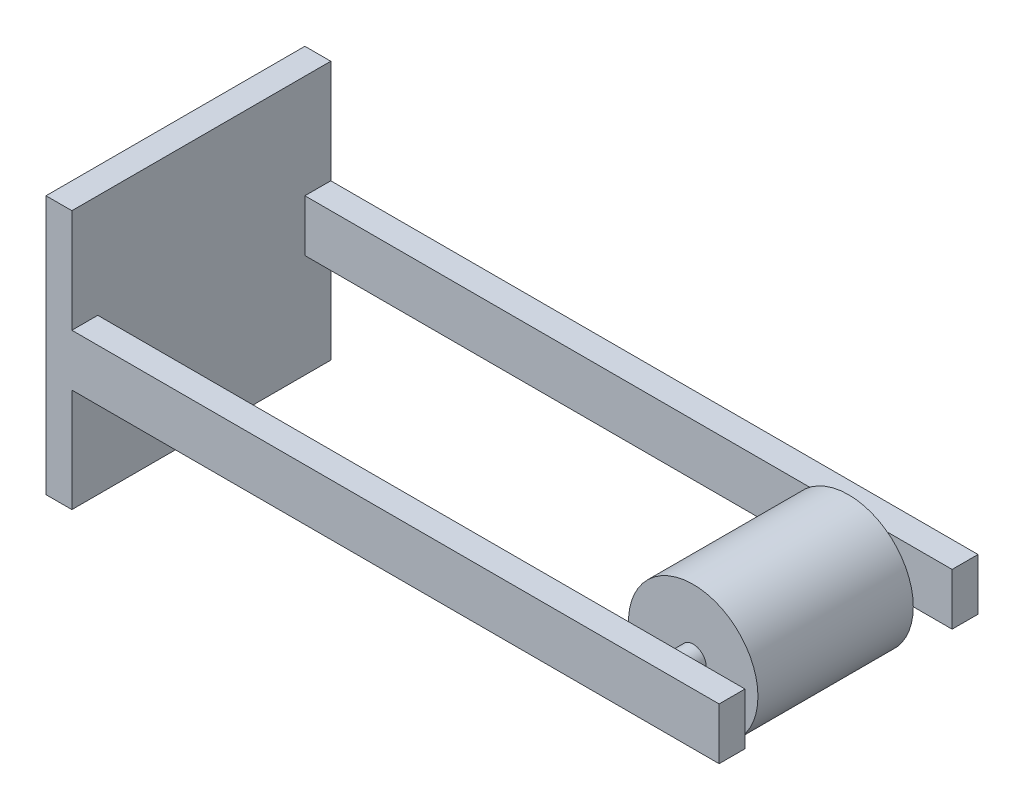
from build123d import *

# Parameters (mm, degrees)
SKETCH_1_W          = 10
SKETCH_1_H          = 10
EXTRUDE_1_DEPTH     = 1
SKETCH_2_W          = 25
SKETCH_2_H          = 2
EXTRUDE_2_DEPTH     = 1
SKETCH_3_W          = 25
SKETCH_3_H          = 2
EXTRUDE_3_DEPTH     = 1
SKETCH_4_R          = 2.5
EXTRUDE_4_DEPTH     = 8
SKETCH_5_R          = 2.5
SKETCH_5_R_2        = 0.5
CUT_EXTRUDE_3_DEPTH = 1
CUT_EXTRUDE_START   = -1
SKETCH_6_R          = 2.5
SKETCH_6_R_2        = 0.5
CUT_EXTRUDE_4_DEPTH = 1


with BuildPart() as part:
    # 草图1 → 凸台-拉伸1 (new body)
    with BuildSketch(Plane(origin=(0, 0, 0), x_dir=(0, 0, -1), z_dir=(1, 0, 0))):
        with Locations((5, 5)):
            Rectangle(SKETCH_1_W, SKETCH_1_H)
    extrude(amount=EXTRUDE_1_DEPTH)

    # 草图2 → 凸台-拉伸2 (add)
    with BuildSketch(Plane.XY):
        with Locations((13.5, 5)):
            Rectangle(SKETCH_2_W, SKETCH_2_H)
    extrude(amount=-EXTRUDE_2_DEPTH)

    # 草图3 → 凸台-拉伸3 (add)
    with BuildSketch(Plane(origin=(0, 0, -10), x_dir=(-1, 0, 0), z_dir=(0, 0, -1))):
        with Locations((-13.5, 5)):
            Rectangle(SKETCH_3_W, SKETCH_3_H)
    extrude(amount=-EXTRUDE_3_DEPTH)

    # 草图4 → 凸台-拉伸4 (add)
    with BuildSketch(Plane(origin=(0, 0, -1), x_dir=(-1, 0, 0), z_dir=(0, 0, -1))):
        with Locations(Location((-23, 5, 0), (0, 0, 203.578178478))):
            Circle(SKETCH_4_R)
    extrude(amount=EXTRUDE_4_DEPTH)

    # 草图5 → 切除-拉伸3 (cut)
    with BuildSketch(Plane.XY.offset(-1)):
        with Locations((23, 5)):
            Circle(SKETCH_5_R)
        with Locations((23, 5)):
            Circle(SKETCH_5_R_2, mode=Mode.SUBTRACT)
    extrude(amount=-CUT_EXTRUDE_3_DEPTH, mode=Mode.SUBTRACT)

    # 草图6 → 切除-拉伸4 (cut)
    with BuildSketch(Plane(origin=(0, 0, -9), x_dir=(-1, 0, 0), z_dir=(0, 0, -1)).offset(CUT_EXTRUDE_START)):
        with Locations(Location((-23, 5, 0), (0, 0, 180))):
            Circle(SKETCH_6_R)
        with Locations(Location((-23, 5, 0), (0, 0, 180))):
            Circle(SKETCH_6_R_2, mode=Mode.SUBTRACT)
    extrude(amount=CUT_EXTRUDE_4_DEPTH, mode=Mode.SUBTRACT)


solid = part.part
